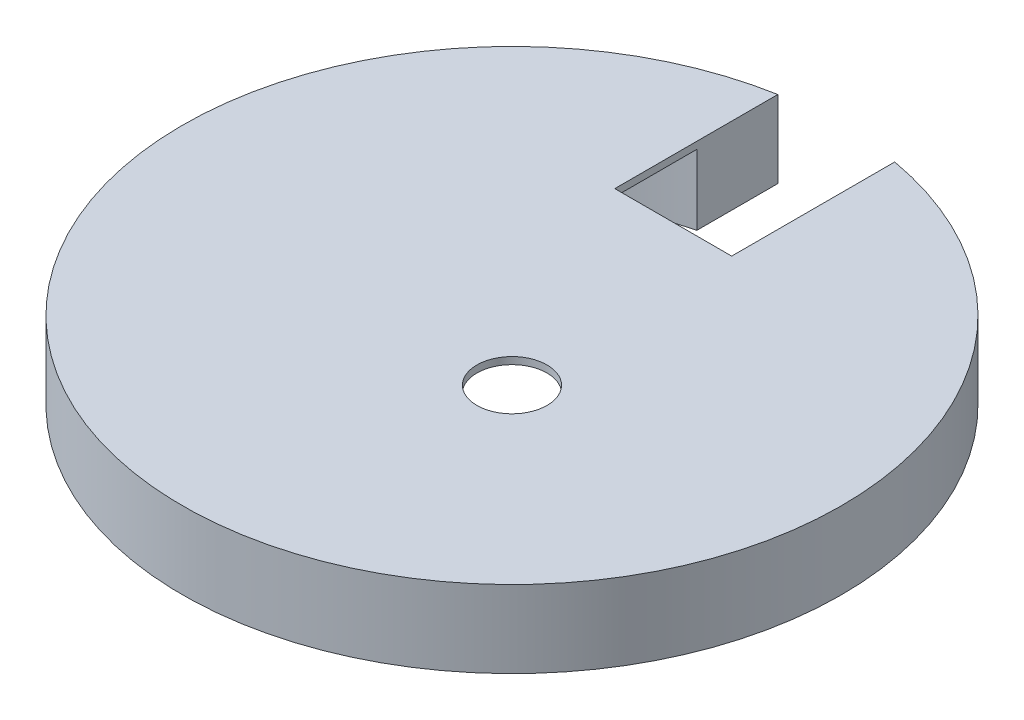
from build123d import *

# Parameters (mm, degrees)
BOSS_EXTRUDE1_DEPTH = 10
BOSS_EXTRUDE2_DEPTH = 1
SKETCH4_R           = 5
CUT_EXTRUDE1_DEPTH  = 68.330244319


with BuildPart() as part:
    # Sketch2 → Boss-Extrude1 (new body)
    with BuildSketch(Plane(origin=(0, 0, 0), x_dir=(1, 0, 0), z_dir=(0, 1, 0))):
        with BuildLine():
            Line((-8.33, 46.225447537), (-8.33, 34.685513519))
            ThreePointArc((-8.33, 34.685513519), (0, -35.67175), (8.33, 34.685513519))
            Line((8.33, 34.685513519), (8.33, 46.225447537))
            ThreePointArc((8.33, 46.225447537), (0, -46.97), (-8.33, 46.225447537))
        make_face()
    extrude(amount=BOSS_EXTRUDE1_DEPTH)

    # Sketch3 → Boss-Extrude2 (add)
    with BuildSketch(Plane(origin=(0, 10, 0), x_dir=(1, 0, 0), z_dir=(0, 1, 0))):
        with BuildLine():
            Line((-8.33, 46.225447537), (-8.33, 22.985447537))
            Line((-8.33, 22.985447537), (8.33, 22.985447537))
            Line((8.33, 22.985447537), (8.33, 46.225447537))
            ThreePointArc((8.33, 46.225447537), (0, -46.97), (-8.33, 46.225447537))
        make_face()
    extrude(amount=BOSS_EXTRUDE2_DEPTH)

    # Sketch4 → Cut-Extrude1 (cut, through all)
    with BuildSketch(Plane(origin=(0, 11, 0), x_dir=(1, 0, 0), z_dir=(0, 1, 0))):
        with Locations(Location((8.605489527, -8.605489527, 0), (0, 0, 270))):
            Circle(SKETCH4_R)
    extrude(amount=-CUT_EXTRUDE1_DEPTH, mode=Mode.SUBTRACT)


solid = part.part
